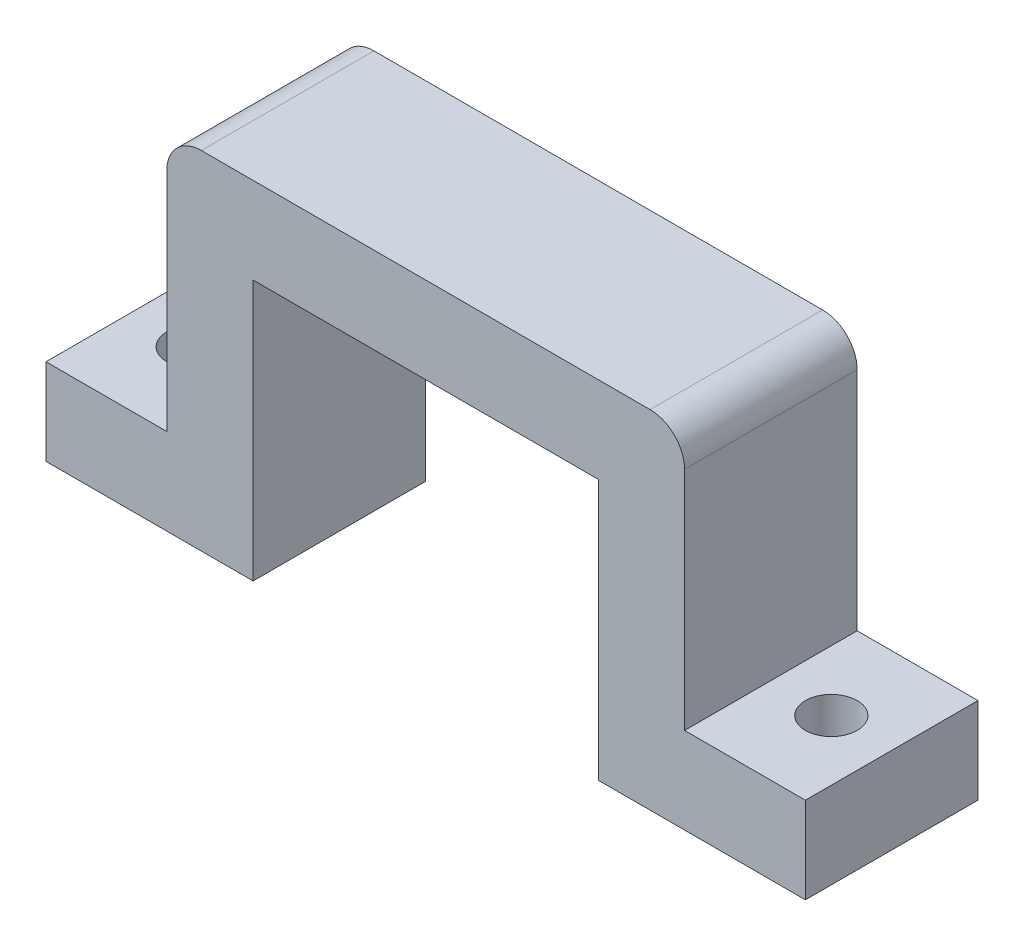
from build123d import *

# Parameters (mm, degrees)
BOSS_EXTRU_1_DEPTH      = 10
ESQUISSE2_R             = 1.5
ENL_V_MAT_EXTRU_1_DEPTH = 10


with BuildPart() as part:
    # Esquisse1 → Boss.-Extru.1 (new body)
    with BuildSketch(Plane.XY):
        with BuildLine():
            Line((0, 0), (0, 15.1))
            Line((0, 15.1), (20, 15.1))
            Line((20, 15.1), (20, 0))
            Line((20, 0), (32, 0))
            Line((32, 0), (32, 5))
            Line((32, 5), (25, 5))
            Line((25, 5), (25, 18.1))
            ThreePointArc((25, 18.1), (24.414213562, 19.514213562), (23, 20.1))
            Line((23, 20.1), (-3, 20.1))
            ThreePointArc((-3, 20.1), (-4.414213562, 19.514213562), (-5, 18.1))
            Line((-5, 18.1), (-5, 5))
            Line((-5, 5), (-12, 5))
            Line((-12, 5), (-12, 0))
            Line((-12, 0), (0, 0))
        make_face()
    extrude(amount=BOSS_EXTRU_1_DEPTH)

    # Esquisse2 → Enlèv. mat.-Extru.1 (cut)
    with BuildSketch(Plane(origin=(0, 5, 0), x_dir=(1, 0, 0), z_dir=(0, 1, 0))):
        with Locations(Location((-8.5, -5, 0), (0, 0, 270))):
            Circle(ESQUISSE2_R)
        with Locations(Location((28.5, -5, 0), (0, 0, 180))):
            Circle(ESQUISSE2_R)
    extrude(amount=-ENL_V_MAT_EXTRU_1_DEPTH, mode=Mode.SUBTRACT)


solid = part.part
